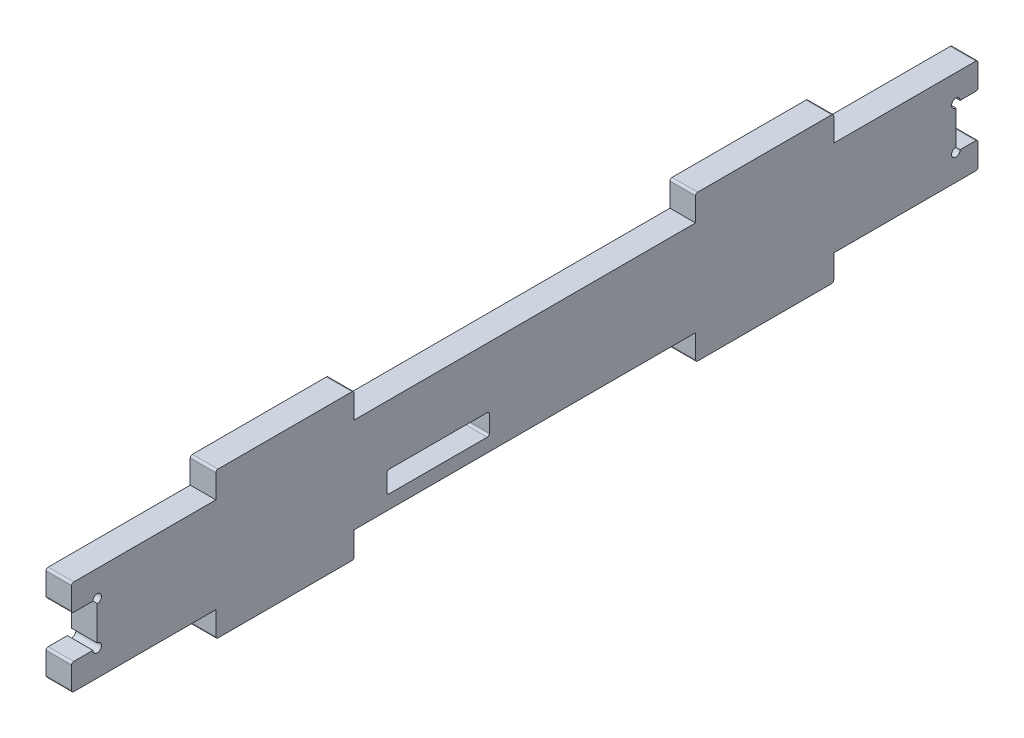
from build123d import *

# Parameters (mm, degrees)
BOSS_EXTRUDE1_DEPTH = 3


with BuildPart() as part:
    # Sketch3 → Boss-Extrude1 (new body)
    with BuildSketch(Plane(origin=(0, 0, 0), x_dir=(0, 0, -1), z_dir=(1, 0, 0))):
        with BuildLine():
            Line((73.286325357, 18.701934502), (88.986325357, 18.701934502))
            ThreePointArc((88.986325357, 18.701934502), (89.163102052, 18.628711197), (89.236325357, 18.451934502))
            Line((89.236325357, 18.451934502), (89.236325357, 15.701934502))
            Line((89.236325357, 15.701934502), (105.886325357, 15.701934502))
            ThreePointArc((105.886325357, 15.701934502), (106.063102052, 15.628711197), (106.136325357, 15.451934502))
            Line((106.136325357, 15.451934502), (106.136325357, 12.883184502))
            ThreePointArc((106.136325357, 12.883184502), (106.063102052, 12.706407807), (105.886325357, 12.633184502))
            Line((105.886325357, 12.633184502), (104.036325357, 12.633184502))
            ThreePointArc((104.036325357, 12.633184502), (103.182771966, 12.986737893), (103.536325357, 12.133184502))
            Line((103.536325357, 12.133184502), (103.536325357, 8.133184502))
            ThreePointArc((103.536325357, 8.133184502), (103.182771966, 7.279631112), (104.036325357, 7.633184502))
            Line((104.036325357, 7.633184502), (105.886325357, 7.633184502))
            ThreePointArc((105.886325357, 7.633184502), (106.063102052, 7.559961197), (106.136325357, 7.383184502))
            Line((106.136325357, 7.383184502), (106.136325357, 4.814434502))
            ThreePointArc((106.136325357, 4.814434502), (106.063102052, 4.637657807), (105.886325357, 4.564434502))
            Line((105.886325357, 4.564434502), (89.236325357, 4.564434502))
            Line((89.236325357, 4.564434502), (89.236325357, 1.814434502))
            ThreePointArc((89.236325357, 1.814434502), (89.163102052, 1.637657807), (88.986325357, 1.564434502))
            Line((88.986325357, 1.564434502), (73.286325357, 1.564434502))
            ThreePointArc((73.286325357, 1.564434502), (73.109548661, 1.637657807), (73.036325357, 1.814434502))
            Line((73.036325357, 1.814434502), (73.036325357, 4.564434502))
            Line((73.036325357, 4.564434502), (33.036325357, 4.564434502))
            Line((33.036325357, 4.564434502), (33.036325357, 1.814434502))
            ThreePointArc((33.036325357, 1.814434502), (32.963102052, 1.637657807), (32.786325357, 1.564434502))
            Line((32.786325357, 1.564434502), (17.086325357, 1.564434502))
            ThreePointArc((17.086325357, 1.564434502), (16.909548661, 1.637657807), (16.836325357, 1.814434502))
            Line((16.836325357, 1.814434502), (16.836325357, 4.564434502))
            Line((16.836325357, 4.564434502), (0.186325357, 4.564434502))
            ThreePointArc((0.186325357, 4.564434502), (0.009548661, 4.637657807), (-0.063674643, 4.814434502))
            Line((-0.063674643, 4.814434502), (-0.063674643, 7.383184502))
            ThreePointArc((-0.063674643, 7.383184502), (0.009548661, 7.559961197), (0.186325357, 7.633184502))
            Line((0.186325357, 7.633184502), (2.436325357, 7.633184502))
            ThreePointArc((2.436325357, 7.633184502), (3.289878747, 7.279631112), (2.936325357, 8.133184502))
            Line((2.936325357, 8.133184502), (2.936325357, 12.133184502))
            ThreePointArc((2.936325357, 12.133184502), (3.289878747, 12.986737893), (2.436325357, 12.633184502))
            Line((2.436325357, 12.633184502), (0.186325357, 12.633184502))
            ThreePointArc((0.186325357, 12.633184502), (0.009548661, 12.706407807), (-0.063674643, 12.883184502))
            Line((-0.063674643, 12.883184502), (-0.063674643, 15.451934502))
            ThreePointArc((-0.063674643, 15.451934502), (0.009548661, 15.628711197), (0.186325357, 15.701934502))
            Line((0.186325357, 15.701934502), (16.836325357, 15.701934502))
            Line((16.836325357, 15.701934502), (16.836325357, 18.451934502))
            ThreePointArc((16.836325357, 18.451934502), (16.909548661, 18.628711197), (17.086325357, 18.701934502))
            Line((17.086325357, 18.701934502), (32.786325357, 18.701934502))
            ThreePointArc((32.786325357, 18.701934502), (32.963102052, 18.628711197), (33.036325357, 18.451934502))
            Line((33.036325357, 18.451934502), (33.036325357, 15.701934502))
            Line((33.036325357, 15.701934502), (73.036325357, 15.701934502))
            Line((73.036325357, 15.701934502), (73.036325357, 18.451934502))
            ThreePointArc((73.036325357, 18.451934502), (73.109548661, 18.628711197), (73.286325357, 18.701934502))
        make_face()
        with BuildLine():
            Line((37.136325357, 6.164434502), (48.636325357, 6.164434502))
            ThreePointArc((48.636325357, 6.164434502), (48.813102052, 6.237657807), (48.886325357, 6.414434502))
            Line((48.886325357, 6.414434502), (48.886325357, 8.414434502))
            ThreePointArc((48.886325357, 8.414434502), (48.813102052, 8.591211197), (48.636325357, 8.664434502))
            Line((48.636325357, 8.664434502), (37.136325357, 8.664434502))
            ThreePointArc((37.136325357, 8.664434502), (36.959548661, 8.591211197), (36.886325357, 8.414434502))
            Line((36.886325357, 8.414434502), (36.886325357, 6.414434502))
            ThreePointArc((36.886325357, 6.414434502), (36.959548661, 6.237657807), (37.136325357, 6.164434502))
        make_face(mode=Mode.SUBTRACT)
    extrude(amount=BOSS_EXTRUDE1_DEPTH)


solid = part.part
